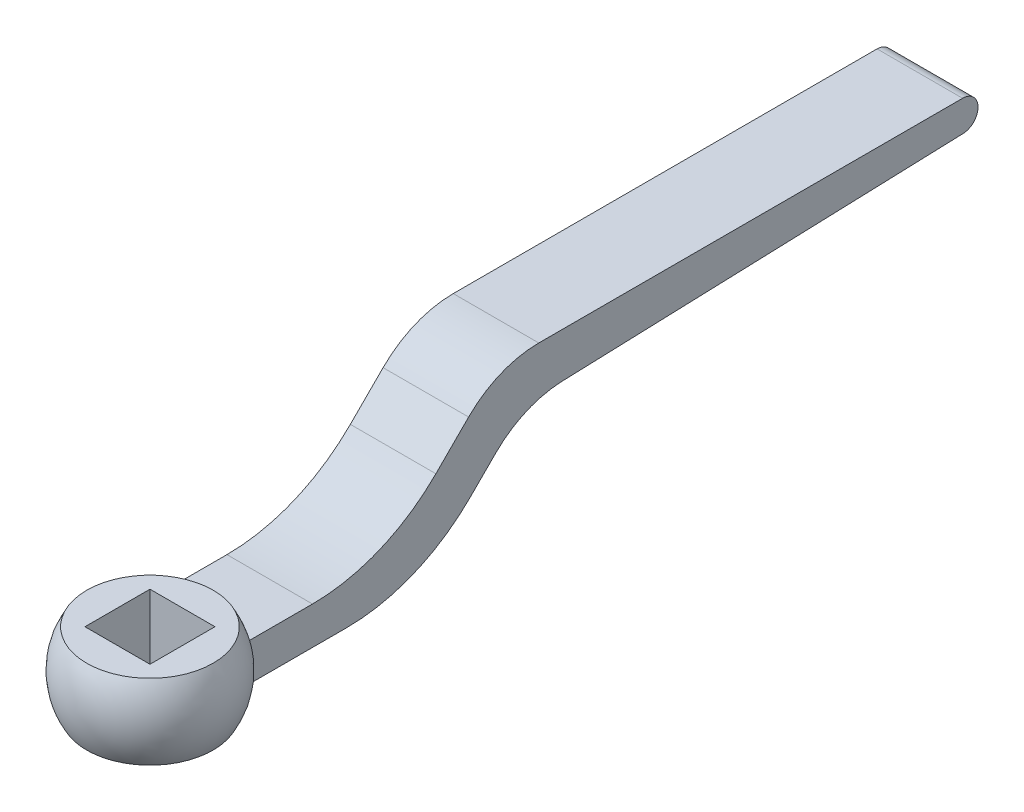
from build123d import *

# Parameters (mm, degrees)
BOSS_EXTRUDE1_DEPTH     = 12.5
CUT_EXTRUDE1_DEPTH      = 219.987073
CUT_EXTRUDE1_DEPTH_BACK = 219.987073
CUT_EXTRUDE2_DEPTH      = 218.323119
CUT_EXTRUDE2_DEPTH_BACK = 218.323119
SKETCH4_W               = 19
SKETCH4_H               = 19
SKETCH6_R               = 1.5
BOSS_EXTRUDE2_DEPTH     = 7.5


with BuildPart() as part:
    # Sketch1 → Boss-Extrude1 (new, symmetric)
    with BuildSketch(Plane(origin=(0, 0, 0), x_dir=(0, 0, -1), z_dir=(1, 0, 0))):
        with BuildLine():
            Line((0, -5.5), (0, 5.5))
            Line((0, 5.5), (20, 5.5))
            ThreePointArc((20, 5.5), (39.516855, 9.382144), (56.062446, 20.437554))
            Line((56.062446, 20.437554), (65.630988, 30.006097))
            ThreePointArc((65.630988, 30.006097), (75.039265, 36.292506), (86.137085, 38.5))
            Line((86.137085, 38.5), (210, 38.5))
            ThreePointArc((210, 38.5), (214.500685, 34.077189), (210.157096, 29.5))
            Line((210.157096, 29.5), (93.053311, 25.410646))
            ThreePointArc((93.053311, 25.410646), (82.501674, 23.023054), (73.5593, 16.934408))
            Line((73.5593, 16.934408), (66.062446, 9.437554))
            ThreePointArc((66.062446, 9.437554), (49.516855, -1.617856), (30, -5.5))
            Line((30, -5.5), (0, -5.5))
        make_face()
    extrude(amount=BOSS_EXTRUDE1_DEPTH, both=True)

    # Sketch2 → Revolve2 (revolve)
    with BuildSketch(Plane(origin=(0, 0, 0), x_dir=(0, 0, -1), z_dir=(1, 0, 0))):
        with BuildLine():
            Line((-36.5, 0), (6.5, 0))
            ThreePointArc((6.5, 0), (-15, 21.5), (-36.5, 0))
        make_face()
    revolve(axis=Axis((0, 0, 36.5), (0, 0, -1)))

    # Sketch3 → Cut-Extrude1 (cut, two sides: drawn at the far end of the back side and taken through both)
    with BuildSketch(Plane(origin=(0, 0, 0), x_dir=(0, 0, -1), z_dir=(1, 0, 0)).offset(-CUT_EXTRUDE1_DEPTH_BACK)):
        with BuildLine():
            Line((-33.472953, 11), (3.472953, 11))
            ThreePointArc((3.472953, 11), (-15, 21.5), (-33.472953, 11))
        make_face()
        with BuildLine():
            Line((-33.472953, -11), (3.472953, -11))
            ThreePointArc((3.472953, -11), (-15, -21.5), (-33.472953, -11))
        make_face()
    extrude(amount=CUT_EXTRUDE1_DEPTH + CUT_EXTRUDE1_DEPTH_BACK, mode=Mode.SUBTRACT)

    # Sketch4 → Cut-Extrude2 (cut, two sides: drawn at the far end of the back side and taken through both)
    with BuildSketch(Plane(origin=(0, 11, 0), x_dir=(1, 0, 0), z_dir=(0, 1, 0)).offset(-CUT_EXTRUDE2_DEPTH_BACK)):
        with Locations((0, -15)):
            Rectangle(SKETCH4_W, SKETCH4_H)
    extrude(amount=CUT_EXTRUDE2_DEPTH + CUT_EXTRUDE2_DEPTH_BACK, mode=Mode.SUBTRACT)

    # Sketch6 → Boss-Extrude2 (add, symmetric)
    with BuildSketch(Plane.XZ.offset(5.5)):
        with Locations(Location((-4, -8, 0), (0, 0, 90))):
            Circle(SKETCH6_R)
    extrude(amount=BOSS_EXTRUDE2_DEPTH, both=True)


solid = part.part
